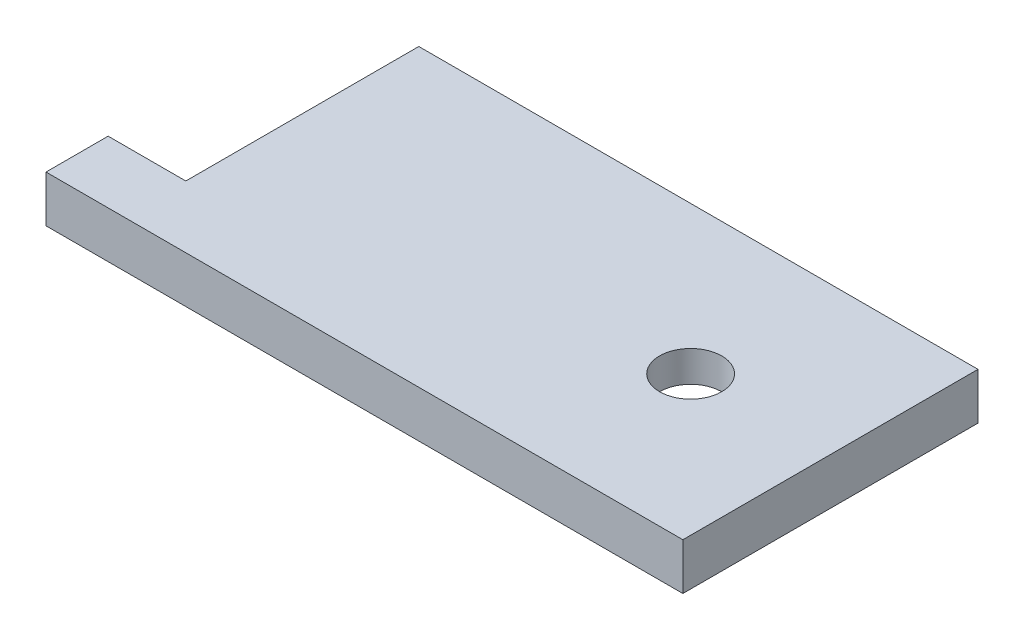
from build123d import *

# Parameters (mm, degrees)
P_IDAT_VYSUNUT_M1_DEPTH  = 19
SKICA2_W                 = 4
SKICA2_H                 = 4
ODEBRAT_VYSUNUT_M1_DEPTH = 15
SKICA3_W                 = 32
SKICA3_H                 = 15
ODEBRAT_VYSUNUT_M2_DEPTH = 1
SKICA4_W                 = 4
SKICA4_H                 = 4
ODEBRAT_VYSUNUT_M3_DEPTH = 50
SKICA5_W                 = 4
SKICA5_H                 = 3
P_IDAT_VYSUNUT_M2_DEPTH  = 5
SKICA6_R                 = 2
ODEBRAT_VYSUNUT_M4_DEPTH = 5
SKICA8_W                 = 4
SKICA8_H                 = 3
ODEBRAT_VYSUNUT_M6_DEPTH = 5
SKICA9_W                 = 4
SKICA9_H                 = 3
P_IDAT_VYSUNUT_M3_DEPTH  = 5


with BuildPart() as part:
    # Skica1 → Přidat vysunutím1 (new body)
    with BuildSketch(Plane.XY):
        Polygon((0, 0), (0, 7), (4, 7), (4, 3), (36, 3), (36, 0), align=None)
    extrude(amount=P_IDAT_VYSUNUT_M1_DEPTH)

    # Skica2 → Odebrat vysunutím1 (cut)
    with BuildSketch(Plane.XY.offset(19)):
        with Locations((2, 5)):
            Rectangle(SKICA2_W, SKICA2_H)
    extrude(amount=-ODEBRAT_VYSUNUT_M1_DEPTH, mode=Mode.SUBTRACT)

    # Skica3 → Odebrat vysunutím2 (cut)
    with BuildSketch(Plane.XZ):
        with Locations((18, 9.5)):
            Rectangle(SKICA3_W, SKICA3_H)
    extrude(amount=-ODEBRAT_VYSUNUT_M2_DEPTH, mode=Mode.SUBTRACT)

    # Skica4 → Odebrat vysunutím3 (cut)
    with BuildSketch(Plane.ZY):
        with Locations((2, 5)):
            Rectangle(SKICA4_W, SKICA4_H)
    extrude(amount=-ODEBRAT_VYSUNUT_M3_DEPTH, mode=Mode.SUBTRACT)

    # Skica5 → Přidat vysunutím2 (add)
    with BuildSketch(Plane.ZY):
        with Locations((2, 1.5)):
            Rectangle(SKICA5_W, SKICA5_H)
    extrude(amount=P_IDAT_VYSUNUT_M2_DEPTH)

    # Skica6 → Odebrat vysunutím4 (cut)
    with BuildSketch(Plane.XZ.offset(-1)):
        with Locations((27, 9.5)):
            Circle(SKICA6_R)
    extrude(amount=-ODEBRAT_VYSUNUT_M4_DEPTH, mode=Mode.SUBTRACT)

    # Skica8 → Odebrat vysunutím6 (cut)
    with BuildSketch(Plane.ZY.offset(5)):
        with Locations((2, 1.5)):
            Rectangle(SKICA8_W, SKICA8_H)
    extrude(amount=-ODEBRAT_VYSUNUT_M6_DEPTH, mode=Mode.SUBTRACT)

    # Skica9 → Přidat vysunutím3 (add)
    with BuildSketch(Plane.ZY):
        with Locations((17, 1.5)):
            Rectangle(SKICA9_W, SKICA9_H)
    extrude(amount=P_IDAT_VYSUNUT_M3_DEPTH)


solid = part.part
